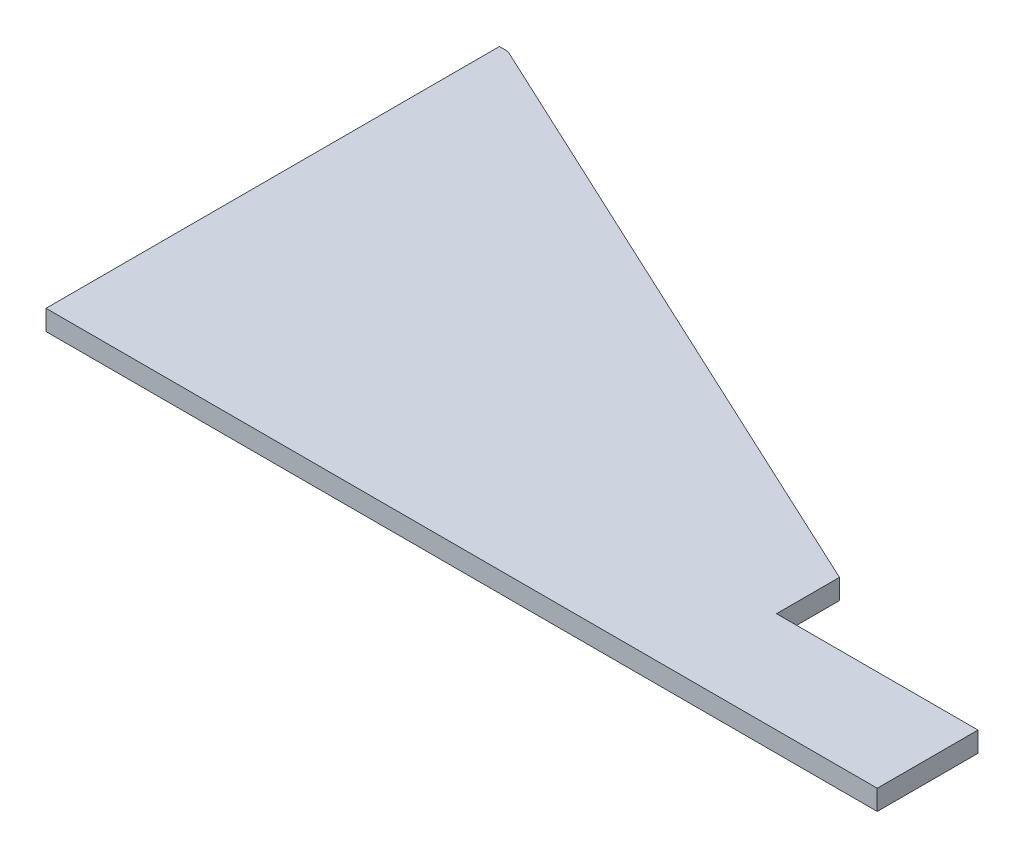
from build123d import *

# Parameters (mm, degrees)
BOSS_EXTRUDE1_DEPTH = 8


with BuildPart() as part:
    # Sketch1 → Boss-Extrude1 (new body)
    with BuildSketch(Plane(origin=(0, 0, 0), x_dir=(1, 0, 0), z_dir=(0, 1, 0))):
        Polygon((0, 0), (330, 0), (330, 40), (250, 40), (250, 65), (3.381704141, 180), (0, 180), align=None)
    extrude(amount=BOSS_EXTRUDE1_DEPTH)


solid = part.part
